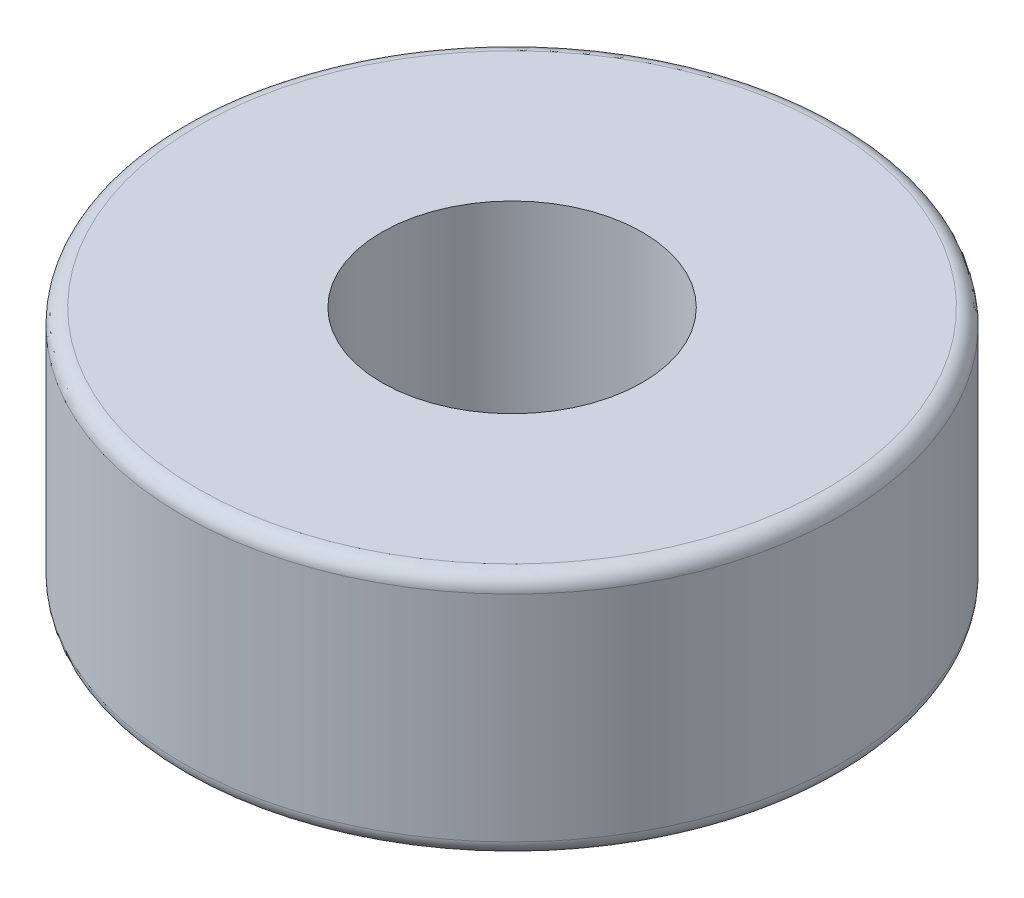
from build123d import *

# Parameters (mm, degrees)
SKETCH1_R           = 10.75
SKETCH1_R_2         = 4.25
BOSS_EXTRUDE1_DEPTH = 8
FILLET1_R           = 0.5
FILLET2_R           = 0.5


with BuildPart() as part:
    # Sketch1 → Boss-Extrude1 (new body)
    with BuildSketch(Plane(origin=(0, 0, 0), x_dir=(1, 0, 0), z_dir=(0, 1, 0))):
        with Locations(Location((0, 0, 0), (0, 0, 270))):
            Circle(SKETCH1_R)
        with Locations(Location((0, 0, 0), (0, 0, 270))):
            Circle(SKETCH1_R_2, mode=Mode.SUBTRACT)
    extrude(amount=BOSS_EXTRUDE1_DEPTH)

    # Fillet1
    fillet1_edges = [part.edges().sort_by_distance(p)[0] for p in [
        (0, 8, -10.75),
    ]]
    fillet(fillet1_edges, radius=FILLET1_R)

    # Fillet2
    fillet2_edges = [part.edges().sort_by_distance(p)[0] for p in [
        (0, 0, -10.75),
    ]]
    fillet(fillet2_edges, radius=FILLET2_R)


solid = part.part
